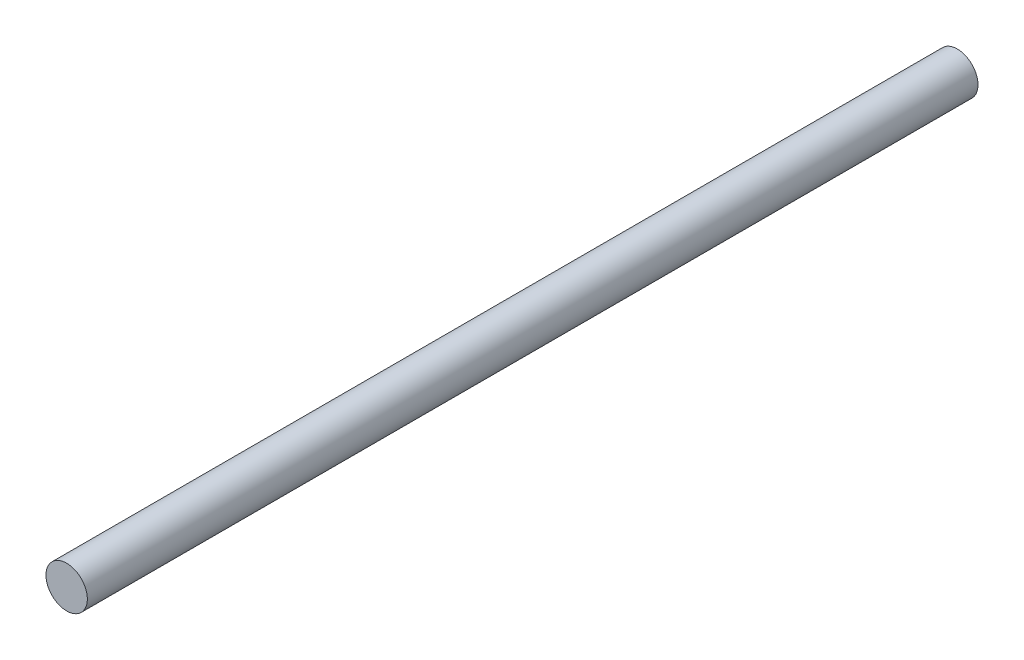
from build123d import *

# Parameters (mm, degrees)
CROQUIS2_R              = 3.025
SALIENTE_EXTRUIR1_DEPTH = 70
CROQUIS4_W              = 31.126188382
CROQUIS4_H              = 7.332915039
CORTAR_EXTRUIR1_DEPTH   = 10


with BuildPart() as part:
    # Croquis2 → Saliente-Extruir1 (new, symmetric)
    with BuildSketch(Plane.XY):
        with Locations((0, 44.649122807)):
            Circle(CROQUIS2_R)
    extrude(amount=SALIENTE_EXTRUIR1_DEPTH, both=True)

    # Croquis4 → Cortar-Extruir1 (cut, symmetric)
    with BuildSketch(Plane(origin=(0, 0, 0), x_dir=(0, 0, -1), z_dir=(1, 0, 0))):
        with Locations((75.763094191, 44.024902431)):
            Rectangle(CROQUIS4_W, CROQUIS4_H)
    extrude(amount=CORTAR_EXTRUIR1_DEPTH, both=True, mode=Mode.SUBTRACT)


solid = part.part
